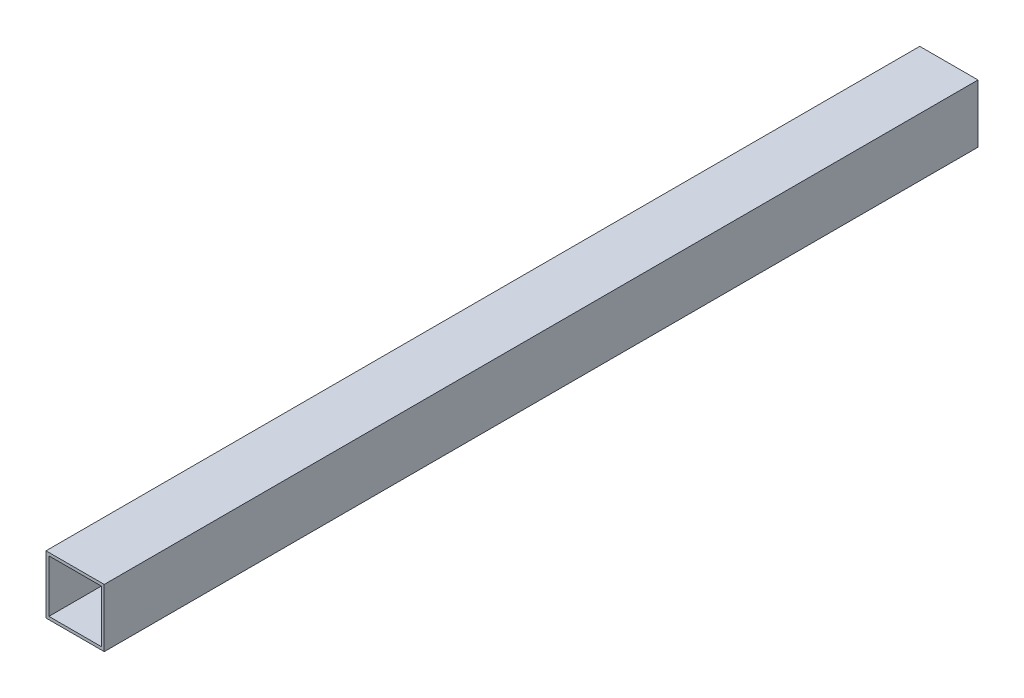
from build123d import *

# Parameters (mm, degrees)
SKETCH3_W           = 20
SKETCH3_H           = 20
SKETCH3_W_2         = 18
SKETCH3_H_2         = 18
BOSS_EXTRUDE1_DEPTH = 300


with BuildPart() as part:
    # Sketch3 → Boss-Extrude1 (new body)
    with BuildSketch(Plane.XY):
        Rectangle(SKETCH3_W, SKETCH3_H)
        Rectangle(SKETCH3_W_2, SKETCH3_H_2, mode=Mode.SUBTRACT)
    extrude(amount=BOSS_EXTRUDE1_DEPTH)


solid = part.part
